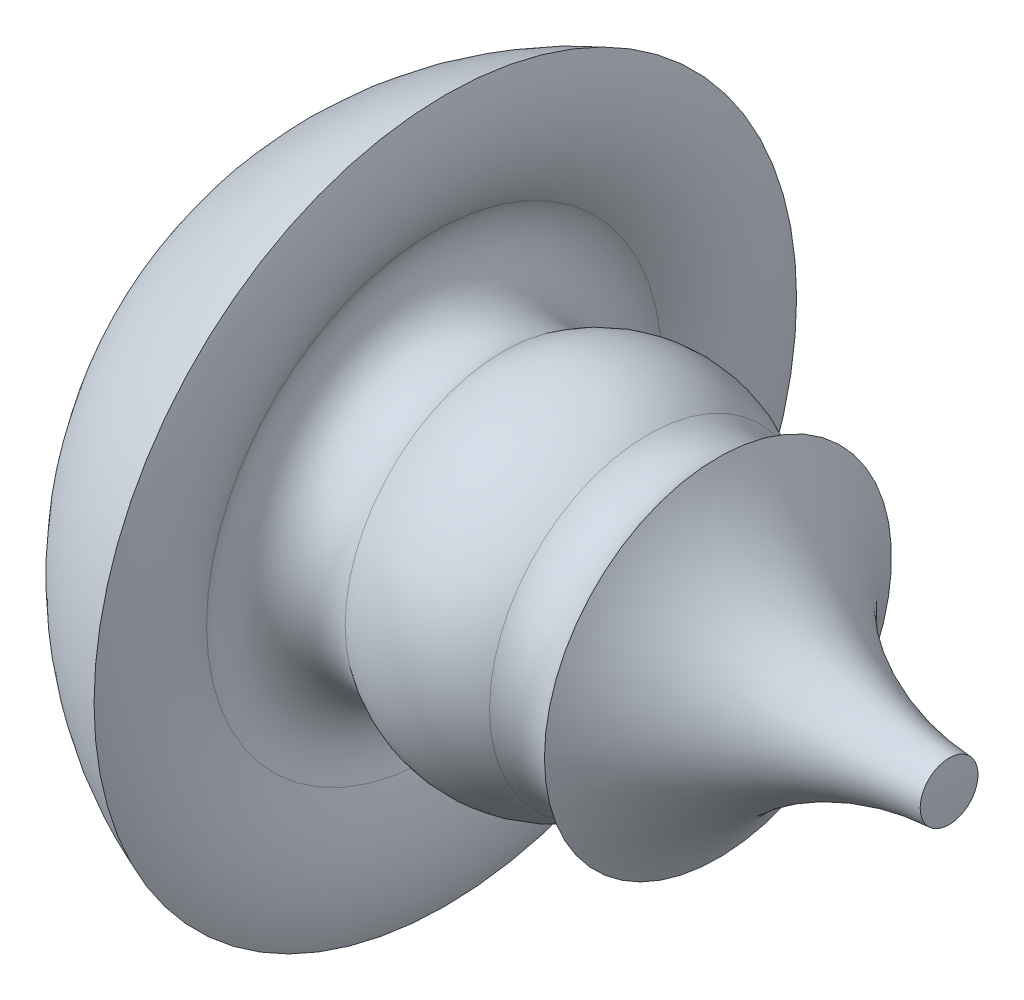
from build123d import *
from build123d.topology import SkipClean

# Parameters (mm, degrees)
SKETCH_3_R = 111.666392741


with BuildPart() as part:
    # 草圖1 → 旋轉1 (revolve)
    with BuildSketch(Plane.XY):
        with BuildLine():
            Line((0, 150), (0, -150))
            ThreePointArc((0, -150), (150, 0), (0, 150))
        make_face()
    revolve(axis=Axis((0, 150, 0), (0, -1, 0)))

    # 草圖2 → 除料-旋轉1 (revolve, cut)
    with SkipClean():  # the faces are left unmerged after this step: merging them gives an invalid solid
        with BuildSketch(Plane.XY, mode=Mode.PRIVATE) as cut_revolve_1_sk:
            with BuildLine():
                ThreePointArc((56.641005887, 148.905996075), (47.888974491, 120), (56.641005887, 91.094003925))
                ThreePointArc((56.641005887, 91.094003925), (54.142135624, 65.857864376), (28.905996075, 63.358994113))
                ThreePointArc((28.905996075, 63.358994113), (0, 72.111025509), (-28.905996075, 63.358994113))
                ThreePointArc((-28.905996075, 63.358994113), (-54.142135624, 65.857864376), (-56.641005887, 91.094003925))
                ThreePointArc((-56.641005887, 91.094003925), (-47.888974491, 120), (-56.641005887, 148.905996075))
                ThreePointArc((-56.641005887, 148.905996075), (-54.142135624, 174.142135624), (-28.905996075, 176.641005887))
                ThreePointArc((-28.905996075, 176.641005887), (0, 167.888974491), (28.905996075, 176.641005887))
                ThreePointArc((28.905996075, 176.641005887), (54.142135624, 174.142135624), (56.641005887, 148.905996075))
            make_face()
        revolve(cut_revolve_1_sk.sketch.rotate(Axis((0, 0, 0), (1, 0, 0)), 90), axis=Axis((0, 0, 0), (1, 0, 0)), mode=Mode.SUBTRACT)

    # 草圖3 → 除料-旋轉4 (revolve, cut)
    with SkipClean():  # the faces are left unmerged after this step: merging them gives an invalid solid
        with BuildSketch(Plane.XY, mode=Mode.PRIVATE) as cut_revolve_4_sk:
            with Locations((154.97116456, 123.10538907)):
                Circle(SKETCH_3_R)
        revolve(cut_revolve_4_sk.sketch.rotate(Axis((0, 0, 0), (1, 0, 0)), 90), axis=Axis((0, 0, 0), (1, 0, 0)), mode=Mode.SUBTRACT)


solid = part.part
